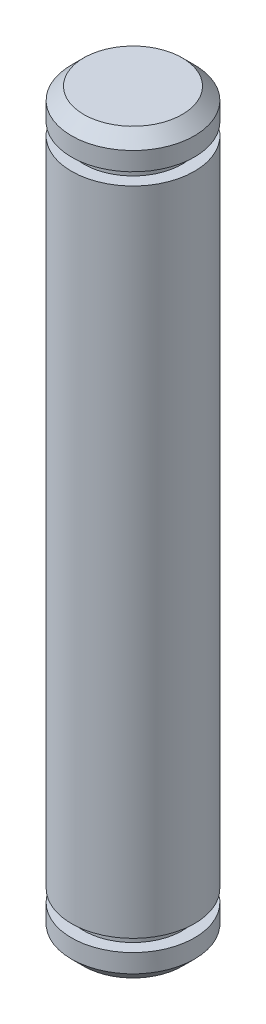
from build123d import *

# Parameters (mm, degrees)
SKETCH1_R           = 5
BOSS_EXTRUDE1_DEPTH = 60
CHAMFER1_SIZE       = 1
CUT_EXTRUDE1_START  = -2.5
SKETCH2_R           = 7.5
SKETCH2_R_2         = 4
CUT_EXTRUDE1_DEPTH  = 1
CUT_EXTRUDE2_START  = -3.5
SKETCH3_R           = 7.5
SKETCH3_R_2         = 4
CUT_EXTRUDE2_DEPTH  = 1


with BuildPart() as part:
    # Sketch1 → Boss-Extrude1 (new body)
    with BuildSketch(Plane(origin=(0, 0, 0), x_dir=(1, 0, 0), z_dir=(0, 1, 0))):
        with Locations(Location((0, 0, 0), (0, 0, 270))):
            Circle(SKETCH1_R)
    extrude(amount=BOSS_EXTRUDE1_DEPTH)

    # Chamfer1
    chamfer1_edges = [part.edges().sort_by_distance(p)[0] for p in [
        (0, 0, -5),
        (0, 60, -5),
    ]]
    chamfer(chamfer1_edges, length=CHAMFER1_SIZE)

    # Sketch2 → Cut-Extrude1 (cut)
    with BuildSketch(Plane.XZ.offset(CUT_EXTRUDE1_START)):
        Circle(SKETCH2_R)
        with Locations(Location((0, 0, 0), (0, 0, 270))):
            Circle(SKETCH2_R_2, mode=Mode.SUBTRACT)
    extrude(amount=-CUT_EXTRUDE1_DEPTH, mode=Mode.SUBTRACT)

    # Sketch3 → Cut-Extrude2 (cut)
    with BuildSketch(Plane(origin=(0, 60, 0), x_dir=(1, 0, 0), z_dir=(0, 1, 0)).offset(CUT_EXTRUDE2_START)):
        Circle(SKETCH3_R)
        with Locations(Location((0, 0, 0), (0, 0, 90))):
            Circle(SKETCH3_R_2, mode=Mode.SUBTRACT)
    extrude(amount=CUT_EXTRUDE2_DEPTH, mode=Mode.SUBTRACT)


solid = part.part
